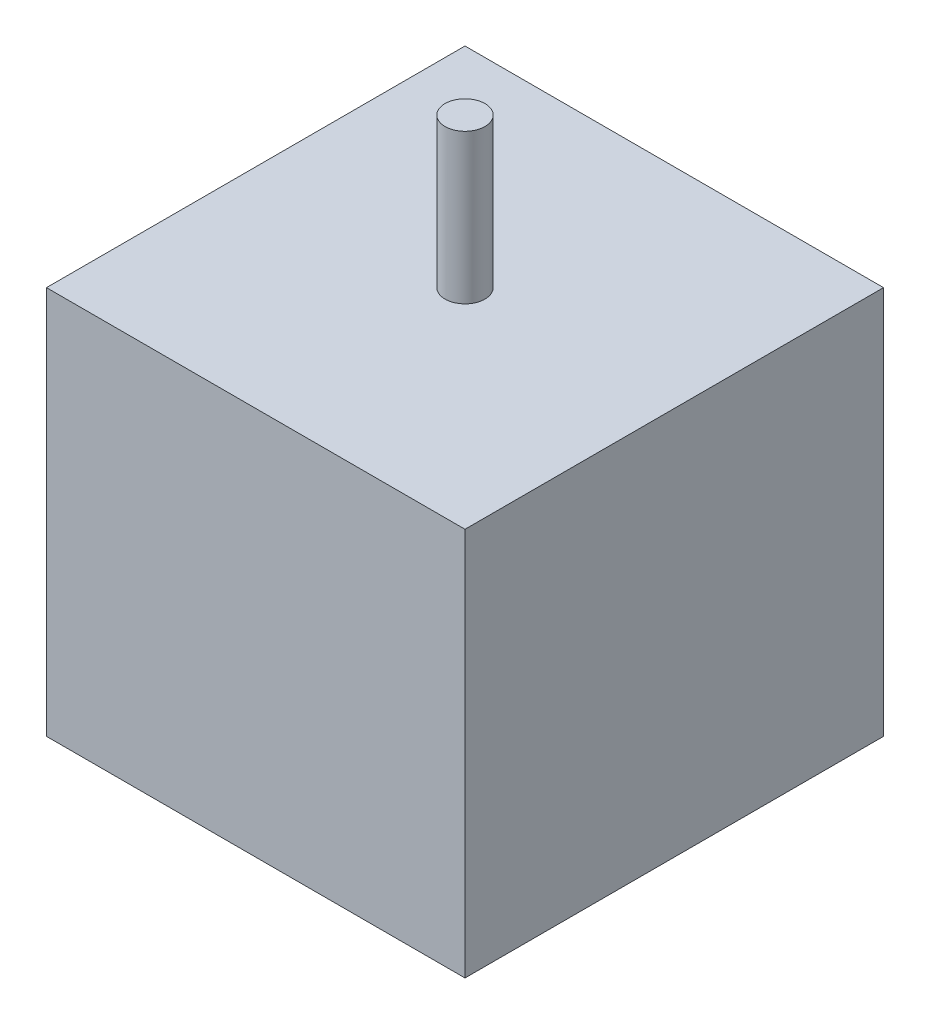
from build123d import *

# Parameters (mm, degrees)
ESQUISSE1_W        = 42
ESQUISSE1_H        = 42
BOSS_EXTRU_1_DEPTH = 39
ESQUISSE4_R        = 2
BOSS_EXTRU_2_DEPTH = 15


with BuildPart() as part:
    # Esquisse1 → Boss.-Extru.1 (new body)
    with BuildSketch(Plane(origin=(0, 0, 0), x_dir=(1, 0, 0), z_dir=(0, 1, 0))):
        Rectangle(ESQUISSE1_W, ESQUISSE1_H)
    extrude(amount=BOSS_EXTRU_1_DEPTH)

    # Esquisse4 → Boss.-Extru.2 (add)
    with BuildSketch(Plane(origin=(0, 39, 0), x_dir=(1, 0, 0), z_dir=(0, 1, 0))):
        with Locations(Location((0, 0, 0), (0, 0, 90))):
            Circle(ESQUISSE4_R)
    extrude(amount=BOSS_EXTRU_2_DEPTH)


solid = part.part
